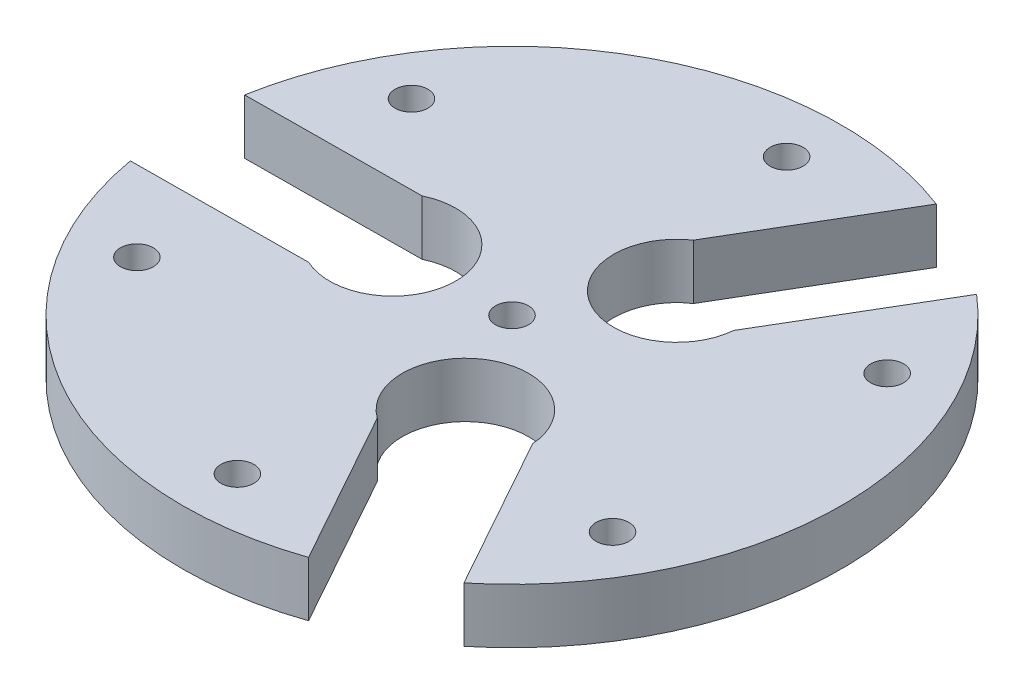
from build123d import *

# Parameters (mm, degrees)
SKETCH5_R           = 30
BOSS_EXTRUDE1_DEPTH = 5
SKETCH6_R           = 5.75
CUT_EXTRUDE1_DEPTH  = 50
SKETCH11_R          = 1.5
CUT_EXTRUDE2_DEPTH  = 43.720018727
SKETCH13_R          = 1.5
CUT_EXTRUDE3_DEPTH  = 10
CIRPATTERN2_COUNT   = 6
CUT_EXTRUDE4_DEPTH  = 10


with BuildPart() as part:
    # Sketch5 → Boss-Extrude1 (new body)
    with BuildSketch(Plane(origin=(0, 0, 0), x_dir=(1, 0, 0), z_dir=(0, 1, 0))):
        with Locations(Location((0, 0, 0), (0, 0, 270))):
            Circle(SKETCH5_R)
    extrude(amount=BOSS_EXTRUDE1_DEPTH)

    # Sketch6 → Cut-Extrude1 (cut)
    with BuildSketch(Plane(origin=(0, 5, 0), x_dir=(1, 0, 0), z_dir=(0, 1, 0))):
        with Locations(Location((5.564652455, 9.430649132, 0), (0, 0, 270))):
            Circle(SKETCH6_R)
        with Locations(Location((5.325305202, -9.567843252, 0), (0, 0, 270))):
            Circle(SKETCH6_R)
        with Locations(Location((-11.00819821, 0.138683741, 0), (0, 0, 270))):
            Circle(SKETCH6_R)
    extrude(amount=-CUT_EXTRUDE1_DEPTH, mode=Mode.SUBTRACT)

    # Sketch11 → Cut-Extrude2 (cut, through all)
    with BuildSketch(Plane(origin=(0, 5, 0), x_dir=(1, 0, 0), z_dir=(0, 1, 0))):
        with Locations(Location((0, 0, 0), (0, 0, 270))):
            Circle(SKETCH11_R)
    extrude(amount=-CUT_EXTRUDE2_DEPTH, mode=Mode.SUBTRACT)

    # Sketch13 → Cut-Extrude3 (cut)
    with BuildSketch(Plane(origin=(0, 5, 0), x_dir=(1, 0, 0), z_dir=(0, 1, 0))):
        with Locations(Location((0, 25, 0), (0, 0, 270))):
            Circle(SKETCH13_R)
    cut_extrude3 = extrude(amount=-CUT_EXTRUDE3_DEPTH, mode=Mode.SUBTRACT)

    # CirPattern2: Cut-Extrude3 ×6 about axis
    cirpattern2_axis = Axis((0, 0, 0), (0, 1, 0))
    for i in range(1, CIRPATTERN2_COUNT):
        add(cut_extrude3.rotate(cirpattern2_axis, i * 360 / CIRPATTERN2_COUNT), mode=Mode.SUBTRACT)

    # Sketch14 → Cut-Extrude4 (cut)
    with BuildSketch(Plane(origin=(0, 5, 0), x_dir=(1, 0, 0), z_dir=(0, 1, 0))):
        with BuildLine():
            Line((9.868938528, -7.038931193), (19.133510592, -23.684357125))
            ThreePointArc((19.133510592, -23.684357125), (17.118789327, -30.75690251), (10.046243942, -28.742181244))
            Line((10.046243942, -28.742181244), (0.781671877, -12.096755312))
            ThreePointArc((0.781671877, -12.096755312), (2.796393143, -5.024209927), (9.868938528, -7.038931193))
        make_face()
        with BuildLine():
            Line((1.086170675, 12.073223814), (10.767141384, 28.479969565))
            ThreePointArc((10.767141384, 28.479969565), (17.888197845, 30.315876663), (19.724104943, 23.194820202))
            Line((19.724104943, 23.194820202), (10.043134234, 6.788074451))
            ThreePointArc((10.043134234, 6.788074451), (2.922077773, 4.952167353), (1.086170675, 12.073223814))
        make_face()
        with BuildLine():
            Line((-10.970227288, -5.061177624), (-29.962029078, -5.199861364))
            ThreePointArc((-29.962029078, -5.199861364), (-35.199861364, -0.037970922), (-30.037970922, 5.199861364))
            Line((-30.037970922, 5.199861364), (-11.046169132, 5.338545105))
            ThreePointArc((-11.046169132, 5.338545105), (-5.808336846, 0.176654663), (-10.970227288, -5.061177624))
        make_face()
    extrude(amount=-CUT_EXTRUDE4_DEPTH, mode=Mode.SUBTRACT)


solid = part.part
